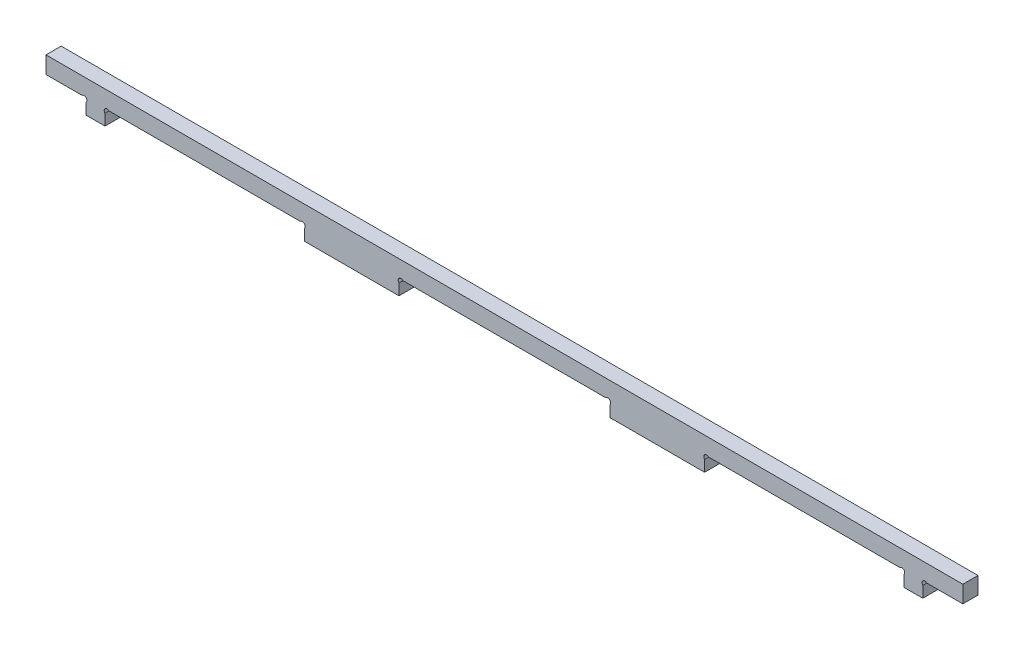
from build123d import *

# Parameters (mm, degrees)
BOSS_EXTRU_1_DEPTH = 8


with BuildPart() as part:
    # Esquisse2 → Boss.-Extru.1 (new body)
    with BuildSketch(Plane.XY):
        with BuildLine():
            Line((-234, 77.582220472), (250, 77.582220472))
            Line((250, 77.582220472), (250, 68.582220472))
            Line((250, 68.582220472), (230.972064578, 68.582220472))
            ThreePointArc((230.972064578, 68.582220472), (228.850744234, 68.582220472), (228.850744234, 66.460900128))
            Line((228.850744234, 66.460900128), (228.850744234, 60.582220472))
            Line((228.850744234, 60.582220472), (218.850744234, 60.582220472))
            Line((218.850744234, 60.582220472), (218.850744234, 66.460900128))
            ThreePointArc((218.850744234, 66.460900128), (218.850744234, 68.582220472), (216.729423891, 68.582220472))
            Line((216.729423891, 68.582220472), (115.787517246, 68.582220472))
            ThreePointArc((115.787517246, 68.582220472), (113.666196902, 68.582220472), (113.666196902, 66.460900128))
            Line((113.666196902, 66.460900128), (113.666196902, 60.582220472))
            Line((113.666196902, 60.582220472), (63.666196902, 60.582220472))
            Line((63.666196902, 60.582220472), (63.666196902, 66.460900128))
            ThreePointArc((63.666196902, 66.460900128), (63.666196902, 68.582220472), (61.544876559, 68.582220472))
            Line((61.544876559, 68.582220472), (-45.544876559, 68.582220472))
            ThreePointArc((-45.544876559, 68.582220472), (-47.666196902, 68.582220472), (-47.666196902, 66.460900128))
            Line((-47.666196902, 66.460900128), (-47.666196902, 60.582220472))
            Line((-47.666196902, 60.582220472), (-97.666196902, 60.582220472))
            Line((-97.666196902, 60.582220472), (-97.666196902, 66.460900128))
            ThreePointArc((-97.666196902, 66.460900128), (-97.666196902, 68.582220472), (-99.787517246, 68.582220472))
            Line((-99.787517246, 68.582220472), (-200.729423891, 68.582220472))
            ThreePointArc((-200.729423891, 68.582220472), (-202.850744234, 68.582220472), (-202.850744234, 66.460900128))
            Line((-202.850744234, 66.460900128), (-202.850744234, 60.582220472))
            Line((-202.850744234, 60.582220472), (-212.850744234, 60.582220472))
            Line((-212.850744234, 60.582220472), (-212.850744234, 66.460900128))
            ThreePointArc((-212.850744234, 66.460900128), (-212.850744234, 68.582220472), (-214.972064578, 68.582220472))
            Line((-214.972064578, 68.582220472), (-234, 68.582220472))
            Line((-234, 68.582220472), (-234, 77.582220472))
        make_face()
    extrude(amount=BOSS_EXTRU_1_DEPTH)


solid = part.part
